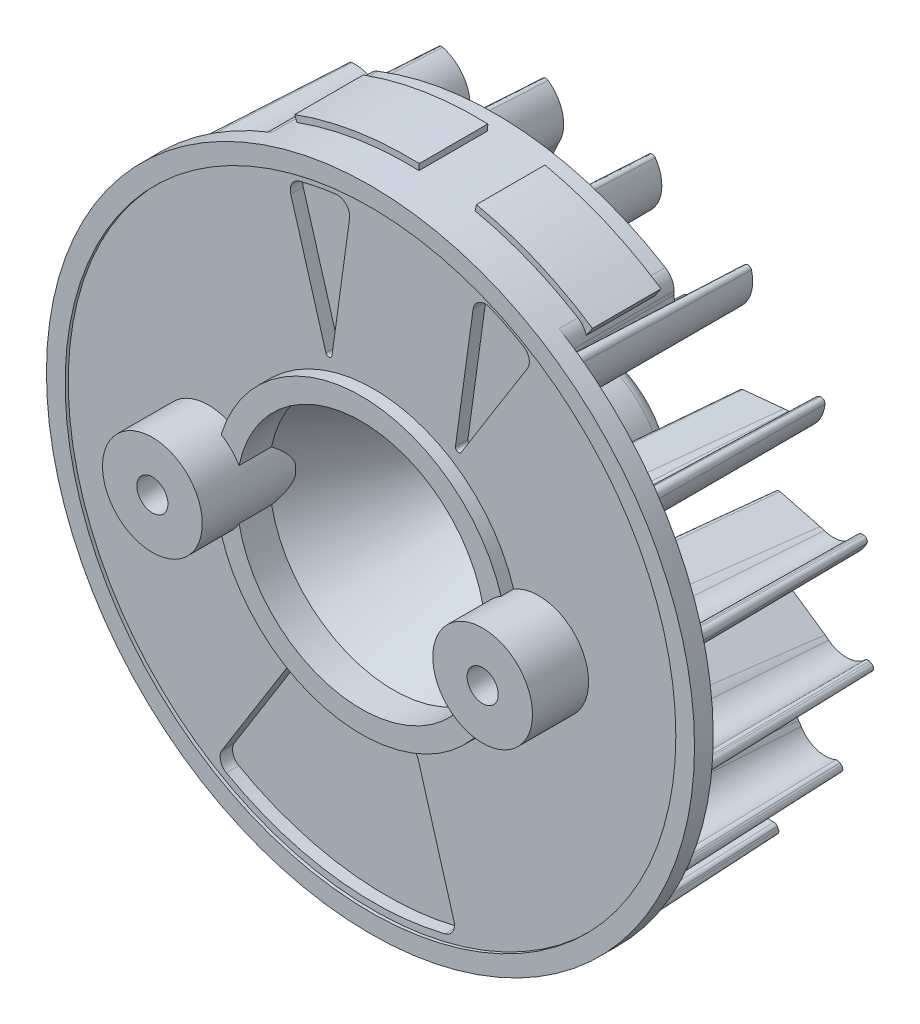
from build123d import *
from build123d.topology import SkipClean

# Parameters (mm, degrees)
ESQUISSE1_R                  = 13
BASE_EXTRUSION_DEPTH         = 33
ESQUISSE2_R                  = 52
BOSS_EXTRU_1_DEPTH           = 3
R_P_TITION_CIRCULAIRE1_COUNT = 18
BOSS_EXTRU_2_START           = 17
BOSS_EXTRU_2_DEPTH           = 17
BOSS_EXTRU_3_DEPTH           = 11
ENL_V_MAT_EXTRU_1_DEPTH      = 83.516665047
ESQUISSE12_R                 = 49
ENL_V_MAT_EXTRU_2_DEPTH      = 0.5
ESQUISSE13_R                 = 23.5
ESQUISSE13_R_2               = 20
BOSS_EXTRU_4_DEPTH           = 2
ESQUISSE15_R                 = 8
BOSS_EXTRU_7_DEPTH           = 15
ESQUISSE16_R                 = 2.5
ENL_V_MAT_EXTRU_3_DEPTH      = 15
ENL_V_START                  = -2
ENL_V_MAT_EXTRU_4_DEPTH      = 2
CONG_3_R                     = 2


with BuildPart() as part:
    # Esquisse1 → Base-Extrusion (new body)
    with BuildSketch(Plane.XY):
        with Locations(Location((0, 0, 0), (0, 0, 180))):
            Circle(ESQUISSE1_R)
    extrude(amount=BASE_EXTRUSION_DEPTH)

    # Esquisse2 → Boss.-Extru.1 (add)
    with BuildSketch(Plane.XY.offset(33)):
        with Locations(Location((0, 0, 0), (0, 0, 238.341180543))):
            Circle(ESQUISSE2_R)
    extrude(amount=BOSS_EXTRU_1_DEPTH)

    # Esquisse3 for Boss.-Lissag → Boss.-Lissage1 section 0
    with BuildSketch(Plane(origin=(0, 0, 33), x_dir=(-1, 0, 0), z_dir=(0, 0, -1))):
        with BuildLine():
            Line((2.211612089, 39.174511923), (4.588425702, 33.911376211))
            # circular arc as an exact rational Bezier (weights 1, cos(half-angle), 1)
            Bezier((4.588425702, 33.911376211), (5, 33), (5.911376211, 33.411574298), weights=[1, 0.707106781, 1])
            Line((5.911376211, 33.411574298), (6.002513832, 33.452731727))
            Bezier((6.002513832, 33.452731727), (6.822752421, 33.823148595), (6.452335554, 34.643387185), weights=[1, 0.707106781, 1])
            Line((6.452335554, 34.643387185), (3.957817067, 40.16716459))
            Bezier((3.957817067, 40.16716459), (3.563001065, 41.041431798), (3.009180792, 41.824697992), weights=[1, 0.9954304, 1])
            Bezier((3.009180792, 41.824697992), (0.021411107, 46.050290851), (4.057528541, 49.289451044), weights=[1, 0.728285822, 1])
            Bezier((4.057528541, 49.289451044), (4.459667392, 49.612185003), (4.384635394, 50.122325241), weights=[1, 0.867684886, 1])
            Line((4.384635394, 50.122325241), (4.351073488, 50.350511595))
            Bezier((4.351073488, 50.350511595), (4.127095738, 51.87332939), (2.909833097, 50.931304055), weights=[1, 0.504763192, 1])
            Bezier((2.909833097, 50.931304055), (-2.706962017, 46.584531947), (1.327649992, 40.739472406), weights=[1, 0.726095385, 1])
            Bezier((1.327649992, 40.739472406), (1.840236528, 39.996873411), (2.211612089, 39.174511923), weights=[1, 0.995953701, 1])
        make_face()
    # Esquisse4 for Boss.-Lissag → Boss.-Lissage1 section 1
    with BuildSketch(Plane(origin=(0, 0, 5), x_dir=(-1, 0, 0), z_dir=(0, 0, -1))):
        with BuildLine():
            Line((1.122594955, 41.355446292), (3.752533501, 35.546589729))
            Bezier((3.752533501, 35.546589729), (4, 35), (4.546589729, 35.247466499), weights=[1, 0.707106781, 1])
            Line((4.546589729, 35.247466499), (4.819884593, 35.371199749))
            Bezier((4.819884593, 35.371199749), (5.367509041, 35.619134713), (5.118538824, 36.166289273), weights=[1, 0.706437806, 1])
            Line((5.118538824, 36.166289273), (2.380197068, 42.184262836))
            Bezier((2.380197068, 42.184262836), (2.228080661, 42.518564613), (2.051850487, 42.840806766), weights=[1, 0.999326196, 1])
            Bezier((2.051850487, 42.840806766), (0.193730879, 46.238434134), (3.276450722, 48.582217097), weights=[1, 0.757974573, 1])
            Bezier((3.276450722, 48.582217097), (3.574617262, 48.808912254), (3.501892621, 49.176342663), weights=[1, 0.848278798, 1])
            Line((3.501892621, 49.176342663), (3.437482644, 49.501764467))
            Bezier((3.437482644, 49.501764467), (3.256354548, 50.416887167), (2.498778713, 49.872519831), weights=[1, 0.540945283, 1])
            Bezier((2.498778713, 49.872519831), (-1.838636804, 46.755805674), (0.754787302, 42.08662674), weights=[1, 0.746930584, 1])
            Bezier((0.754787302, 42.08662674), (0.953665062, 41.728568894), (1.122594955, 41.355446292), weights=[1, 0.999162265, 1])
        make_face()
    boss_lissage1 = loft()

    # Répétition circulaire1: Boss.-Lissage1 ×18 about axis
    r_p_tition_circulaire1_axis = Axis((0, 0, -50), (0, 0, 1))
    for i in range(1, R_P_TITION_CIRCULAIRE1_COUNT):
        add(boss_lissage1.rotate(r_p_tition_circulaire1_axis, i * 360 / R_P_TITION_CIRCULAIRE1_COUNT))

    # Esquisse6 → Boss.-Extru.2 (add)
    with SkipClean():  # the faces are left unmerged after this step: merging them gives an invalid solid
        with BuildSketch(Plane(origin=(0, 0, 33), x_dir=(-1, 0, 0), z_dir=(0, 0, -1)).offset(BOSS_EXTRU_2_START)):
            with BuildLine():
                Line((-24.893475084, 34.127297447), (-16.765108247, 28.638436298))
                ThreePointArc((-16.765108247, 28.638436298), (-15.271653034, 27.06029911), (-14.588609759, 24.997684908))
                Line((-14.588609759, 24.997684908), (-9.24320984, -27.871276095))
                ThreePointArc((-9.24320984, -27.871276095), (-9.384533465, -29.654507522), (-10.144499415, -31.273871114))
                Line((-10.144499415, -31.273871114), (-15.873728272, -39.32219937))
                ThreePointArc((-15.873728272, -39.32219937), (-16.79735578, -43.597264757), (-20.730545507, -45.510191941))
                Line((-20.730545507, -45.510191941), (-20.730545507, -45.679620796))
                ThreePointArc((-20.730545507, -45.679620796), (-20.206088963, -47.37422535), (-18.816089109, -48.476332273))
                ThreePointArc((-18.816089109, -48.476332273), (4.733273554, -51.784130016), (27.292720353, -44.261805383))
                ThreePointArc((27.292720353, -44.261805383), (28.337657469, -43.170474269), (28.718140332, -41.708239688))
                Line((28.718140332, -41.708239688), (28.718140332, -40.922363535))
                ThreePointArc((28.718140332, -40.922363535), (28.740457634, -40.557116019), (28.807077497, -40.19730273))
                ThreePointArc((28.807077497, -40.19730273), (28.163570099, -36.315561152), (24.893475084, -34.127297447))
                Line((24.893475084, -34.127297447), (16.765108247, -28.638436298))
                ThreePointArc((16.765108247, -28.638436298), (15.271653034, -27.06029911), (14.588609759, -24.997684908))
                Line((14.588609759, -24.997684908), (9.24320984, 27.871276095))
                ThreePointArc((9.24320984, 27.871276095), (9.384533465, 29.654507522), (10.144499415, 31.273871114))
                Line((10.144499415, 31.273871114), (15.873728272, 39.32219937))
                ThreePointArc((15.873728272, 39.32219937), (16.79735578, 43.597264757), (20.730545507, 45.510191941))
                Line((20.730545507, 45.510191941), (20.730545507, 45.679620796))
                ThreePointArc((20.730545507, 45.679620796), (20.206088963, 47.37422535), (18.816089109, 48.476332273))
                ThreePointArc((18.816089109, 48.476332273), (-4.733273554, 51.784130016), (-27.292720353, 44.261805383))
                ThreePointArc((-27.292720353, 44.261805383), (-28.337657469, 43.170474269), (-28.718140332, 41.708239688))
                Line((-28.718140332, 41.708239688), (-28.718140332, 41.153760154))
                ThreePointArc((-28.718140332, 41.153760154), (-28.747839966, 40.609596327), (-28.836586041, 40.071897085))
                ThreePointArc((-28.836586041, 40.071897085), (-28.128312771, 36.261649848), (-24.893475084, 34.127297447))
            make_face()
        extrude(amount=-BOSS_EXTRU_2_DEPTH)

    # Esquisse7 → Boss.-Extru.3 (add)
    with SkipClean():  # the faces are left unmerged after this step: merging them gives an invalid solid
        with BuildSketch(Plane(origin=(0, 0, 30), x_dir=(-1, 0, 0), z_dir=(0, 0, -1))):
            with BuildLine():
                Line((-27.796991441, 41.24714859), (-29.61923349, 43.951120662))
                ThreePointArc((-29.61923349, 43.951120662), (-20.688775567, 48.795230971), (-10.998095488, 51.846329625))
                Line((-10.998095488, 51.846329625), (-10.321467848, 48.656626491))
                ThreePointArc((-10.321467848, 48.656626491), (-19.415955432, 45.793238307), (-27.796991441, 41.24714859))
            make_face()
            with BuildLine():
                Line((-1.715527038, 49.709727086), (-1.827989047, 52.96846662))
                ThreePointArc((-1.827989047, 52.96846662), (8.312456163, 52.344083453), (18.147454908, 49.796283801))
                Line((18.147454908, 49.796283801), (17.030982552, 46.732704109))
                ThreePointArc((17.030982552, 46.732704109), (7.801055111, 49.12375738), (-1.715527038, 49.709727086))
            make_face()
        extrude(amount=BOSS_EXTRU_3_DEPTH)

    # Esquisse8 → Boss.-Révol.1 (revolve)
    with SkipClean():  # the faces are left unmerged after this step: merging them gives an invalid solid
        with BuildSketch(Plane(origin=(0, 0, 0), x_dir=(1, 0, 0), z_dir=(0, 1, 0)), mode=Mode.PRIVATE) as boss_r_vol_1_sk:
            with BuildLine():
                Line((-13.63746992, -11.924053429), (-24.01147711, -30.449066267))
                ThreePointArc((-24.01147711, -30.449066267), (-25.850657371, -32.322611214), (-28.385550885, -33.006036097))
                Line((-28.385550885, -33.006036097), (-31, -33))
                Line((-31, -33), (-31.002308745, -34))
                Line((-31.002308745, -34), (-26, -34))
                Line((-26, -34), (-12, -34))
                Line((-12, -34), (-12, -9))
                Line((-12, -9), (-12, -6))
                Line((-12, -6), (-13, -6))
                Line((-13, -6), (-13, -9.481036584))
                ThreePointArc((-13, -9.481036584), (-13.161991608, -10.743444918), (-13.63746992, -11.924053429))
            make_face()
        revolve(boss_r_vol_1_sk.sketch.rotate(Axis((0, 0, -4.292635801), (0, 0, 1)), 197.079108815), axis=Axis((0, 0, -4.292635801), (0, 0, 1)))

    # Esquisse9 → Enlèvement de matière-Révolution1 (revolve, cut)
    with SkipClean():  # the faces are left unmerged after this step: merging them gives an invalid solid
        with BuildSketch(Plane(origin=(0, 0, 0), x_dir=(1, 0, 0), z_dir=(0, 1, 0)), mode=Mode.PRIVATE) as enl_vement_de_mati_re_r_volution1_sk:
            Polygon((-6, 4), (0, 4), (0, -36), (-20, -36), (-20, -32.282926691), (-10, -13), (-10, -9), (-5, -9), (-5, -7), (-6, -7), align=None)
        revolve(enl_vement_de_mati_re_r_volution1_sk.sketch.rotate(Axis((0, 0, -5.302277191), (0, 0, 1)), 197.079108815), axis=Axis((0, 0, -5.302277191), (0, 0, 1)), mode=Mode.SUBTRACT)

    # Esquisse10 → Enlèv. mat.-Extru.1 (cut, through all)
    with SkipClean():  # the faces are left unmerged after this step: merging them gives an invalid solid
        with BuildSketch(Plane(origin=(0, 0, 0), x_dir=(-1, 0, 0), z_dir=(0, 0, -1))):
            Polygon((-2.450319721, 3.268934576), (-5.175710601, 4.945909399), (-6.747874497, 2.390855449), (-4.022483617, 0.713880627), align=None)
        extrude(amount=-ENL_V_MAT_EXTRU_1_DEPTH, mode=Mode.SUBTRACT)

    # Esquisse12 → Enlèv. mat.-Extru.2 (cut)
    with SkipClean():  # the faces are left unmerged after this step: merging them gives an invalid solid
        with BuildSketch(Plane.XY.offset(36)):
            Circle(ESQUISSE12_R)
        extrude(amount=-ENL_V_MAT_EXTRU_2_DEPTH, mode=Mode.SUBTRACT)

    # Esquisse13 → Boss.-Extru.4 (add)
    with SkipClean():  # the faces are left unmerged after this step: merging them gives an invalid solid
        with BuildSketch(Plane.XY.offset(35.5)):
            Circle(ESQUISSE13_R)
            Circle(ESQUISSE13_R_2, mode=Mode.SUBTRACT)
        extrude(amount=BOSS_EXTRU_4_DEPTH)

    # Esquisse15 → Boss.-Extru.7 (add)
    with SkipClean():  # the faces are left unmerged after this step: merging them gives an invalid solid
        with BuildSketch(Plane.XY.offset(44.5)):
            with Locations((26.5, 0)):
                Circle(ESQUISSE15_R)
            with Locations((-26.5, 0)):
                Circle(ESQUISSE15_R)
        extrude(amount=-BOSS_EXTRU_7_DEPTH)

    # Esquisse16 → Enlèv. mat.-Extru.3 (cut)
    with SkipClean():  # the faces are left unmerged after this step: merging them gives an invalid solid
        with BuildSketch(Plane.XY.offset(44.5)):
            with Locations((-26.5, 0)):
                Circle(ESQUISSE16_R)
            with Locations((26.5, 0)):
                Circle(ESQUISSE16_R)
        extrude(amount=-ENL_V_MAT_EXTRU_3_DEPTH, mode=Mode.SUBTRACT)

    # Esquisse17 → Enlèv. mat.-Extru.4 (cut)
    with SkipClean():  # the faces are left unmerged after this step: merging them gives an invalid solid
        with BuildSketch(Plane.XY.offset(35.5).offset(ENL_V_START)):
            with BuildLine():
                Line((13.130881741, 22.012486784), (15.961102363, 42.53158629))
                ThreePointArc((15.961102363, 42.53158629), (16.955352985, 43.997807833), (18.723982419, 44.09924668))
                ThreePointArc((18.723982419, 44.09924668), (21.398724882, 42.86520324), (23.992573089, 41.469115157))
                ThreePointArc((23.992573089, 41.469115157), (24.931958755, 40.220329788), (24.686430492, 38.677077962))
                Line((24.686430492, 38.677077962), (14.050050798, 21.678943692))
                ThreePointArc((14.050050798, 21.678943692), (13.455637042, 21.474156488), (13.130881741, 22.012486784))
            make_face()
            with BuildLine():
                Line((-6.681540843, 24.745234727), (-3.851320222, 45.264334232))
                ThreePointArc((-3.851320222, 45.264334232), (-4.411522515, 46.944963074), (-6.086651418, 47.521403071))
                ThreePointArc((-6.086651418, 47.521403071), (-8.995590287, 47.057522573), (-11.87052285, 46.41574908))
                ThreePointArc((-11.87052285, 46.41574908), (-13.112893188, 45.467895573), (-13.294309299, 43.915800691))
                Line((-13.294309299, 43.915800691), (-7.656682581, 24.672975882))
                ThreePointArc((-7.656682581, 24.672975882), (-7.13990228, 24.314920533), (-6.681540843, 24.745234727))
            make_face()
            with BuildLine():
                Line((7.147369316, -24.396006064), (12.895467377, -44.015901014))
                ThreePointArc((12.895467377, -44.015901014), (12.709601096, -45.575769177), (11.454305835, -46.520210159))
                ThreePointArc((11.454305835, -46.520210159), (-6.5462449, -47.460275527), (-23.620176278, -41.682350557))
                ThreePointArc((-23.620176278, -41.682350557), (-24.572928067, -40.433351361), (-24.329579488, -38.881411791))
                Line((-24.329579488, -38.881411791), (-13.484776071, -21.550192907))
                ThreePointArc((-13.484776071, -21.550192907), (-12.31417253, -20.681180374), (-10.864687821, -20.83767162))
                ThreePointArc((-10.864687821, -20.83767162), (-3.210978833, -23.279596537), (4.81800191, -23.000801238))
                ThreePointArc((4.81800191, -23.000801238), (6.255727527, -23.242545899), (7.147369316, -24.396006064))
            make_face()
        extrude(amount=ENL_V_MAT_EXTRU_4_DEPTH, mode=Mode.SUBTRACT)

    # Congé3
    cong_3_edges = [part.edges().sort_by_distance(p)[0] for p in [
        (13, 0, 0),
    ]]
    fillet(cong_3_edges, radius=CONG_3_R)


solid = part.part
